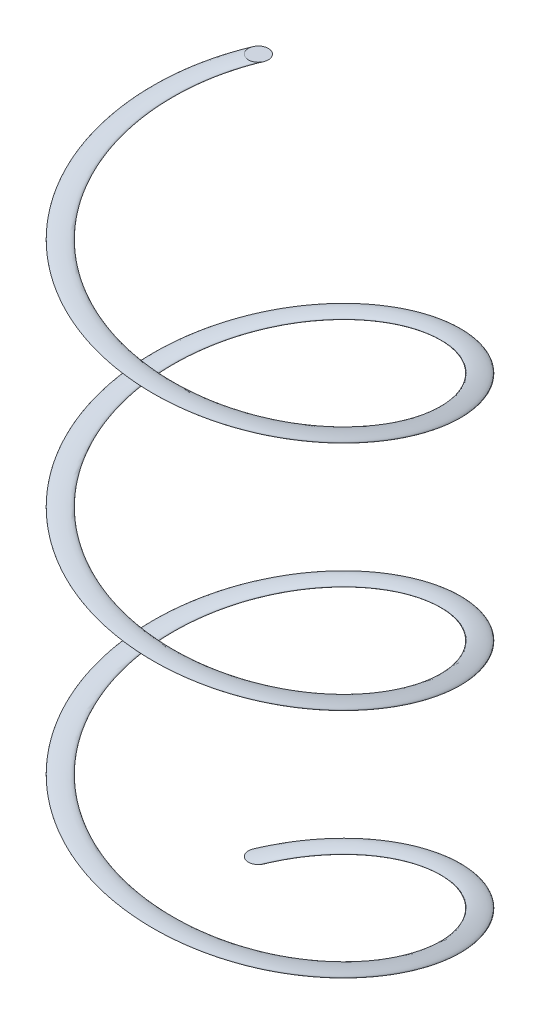
from build123d import *

# Parameters (mm, degrees)
SWEEP1_PITCH       = 29.5275
SWEEP1_HEIGHT      = 88.5825
SWEEP1_RADIUS      = 19.05
SWEEP1_START_ANGLE = -135
SKETCH4_R          = 1.27


with BuildPart() as part:
    # Sweep1: sweep along a helix
    with BuildLine() as sweep1_path:
        add(Helix(SWEEP1_PITCH, SWEEP1_HEIGHT, SWEEP1_RADIUS, center=(0, 0, 0), direction=(0, 1, 0), lefthand=True, mode=Mode.PRIVATE).rotate(Axis((0, 0, 0), (0, 1, 0)), SWEEP1_START_ANGLE))
    # Sketch4 → Sweep1 (sweep)
    with BuildSketch(Plane(origin=(0, 0, 0), x_dir=(1, 0, 0), z_dir=(0, 1, 0))):
        with Locations((-14.084737163, 12.605708763)):
            Circle(SKETCH4_R)
    sweep(path=sweep1_path.line, is_frenet=True)


solid = part.part
